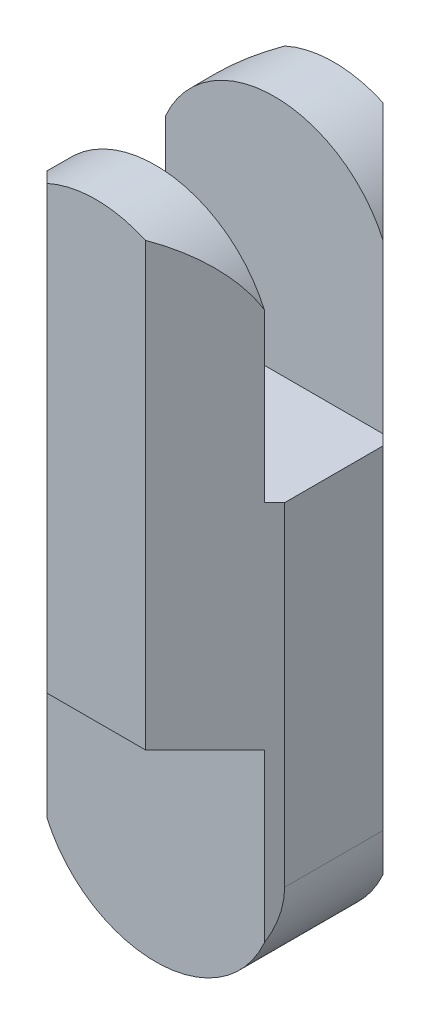
from build123d import *

# Parameters (mm, degrees)
EXTRUDE_1_DEPTH     = 58
CUT_EXTRUDE_1_DEPTH = 66
CUT_EXTRUDE_2_DEPTH = 5
CUT_EXTRUDE_START   = -5
CUT_EXTRUDE_3_DEPTH = 5
SKETCH_6_W          = 20
SKETCH_6_H          = 20
CUT_EXTRUDE_4_DEPTH = 5
CUT_EXTRUDE_5_DEPTH = 30


with BuildPart() as part:
    # 草图1 → 凸台-拉伸1 (new body)
    with BuildSketch(Plane(origin=(0, 0, 0), x_dir=(1, 0, 0), z_dir=(0, 1, 0))):
        Polygon((10, 4.142135624), (4.142135624, 10), (-4.142135624, 10), (-10, 4.142135624), (-10, -4.142135624), (-4.142135624, -10), (4.142135624, -10), (10, -4.142135624), align=None)
    extrude(amount=EXTRUDE_1_DEPTH)

    # 草图2 → 切除-拉伸1 (cut)
    with BuildSketch(Plane.XY.offset(10)):
        with BuildLine():
            Line((-10, 10), (-10, -2.389295552))
            Line((-10, -2.389295552), (10, -2.389295552))
            Line((10, -2.389295552), (10, 10))
            ThreePointArc((10, 10), (0, 0), (-10, 10))
        make_face()
    extrude(amount=-CUT_EXTRUDE_1_DEPTH, mode=Mode.SUBTRACT)

    # 草图4 → 切除-拉伸2 (cut)
    with BuildSketch(Plane.XY.offset(10)):
        with BuildLine():
            Line((-10, 10), (-10, 20))
            Line((-10, 20), (10, 20))
            Line((10, 20), (10, 10))
            ThreePointArc((10, 10), (0, 0), (-10, 10))
        make_face()
    extrude(amount=-CUT_EXTRUDE_2_DEPTH, mode=Mode.SUBTRACT)

    # 草图5 → 切除-拉伸3 (cut)
    with BuildSketch(Plane(origin=(0, 0, -10), x_dir=(-1, 0, 0), z_dir=(0, 0, -1)).offset(CUT_EXTRUDE_START)):
        with BuildLine():
            Line((-10, 10), (-10, 20))
            Line((-10, 20), (10, 20))
            Line((10, 20), (10, 10))
            ThreePointArc((10, 10), (0, 0), (-10, 10))
        make_face()
    extrude(amount=CUT_EXTRUDE_3_DEPTH, mode=Mode.SUBTRACT)

    # 草图6 → 切除-拉伸4 (cut, symmetric)
    with BuildSketch(Plane.XY):
        with Locations((0, 48)):
            Rectangle(SKETCH_6_W, SKETCH_6_H)
    extrude(amount=CUT_EXTRUDE_4_DEPTH, both=True, mode=Mode.SUBTRACT)

    # 草图7 → 切除-拉伸5 (cut)
    with BuildSketch(Plane.XY.offset(10)):
        with BuildLine():
            Line((-10, 48), (-10, 63.661192365))
            Line((-10, 63.661192365), (10, 63.661192365))
            Line((10, 63.661192365), (10, 48))
            ThreePointArc((10, 48), (0, 58), (-10, 48))
        make_face()
    extrude(amount=-CUT_EXTRUDE_5_DEPTH, mode=Mode.SUBTRACT)


solid = part.part
